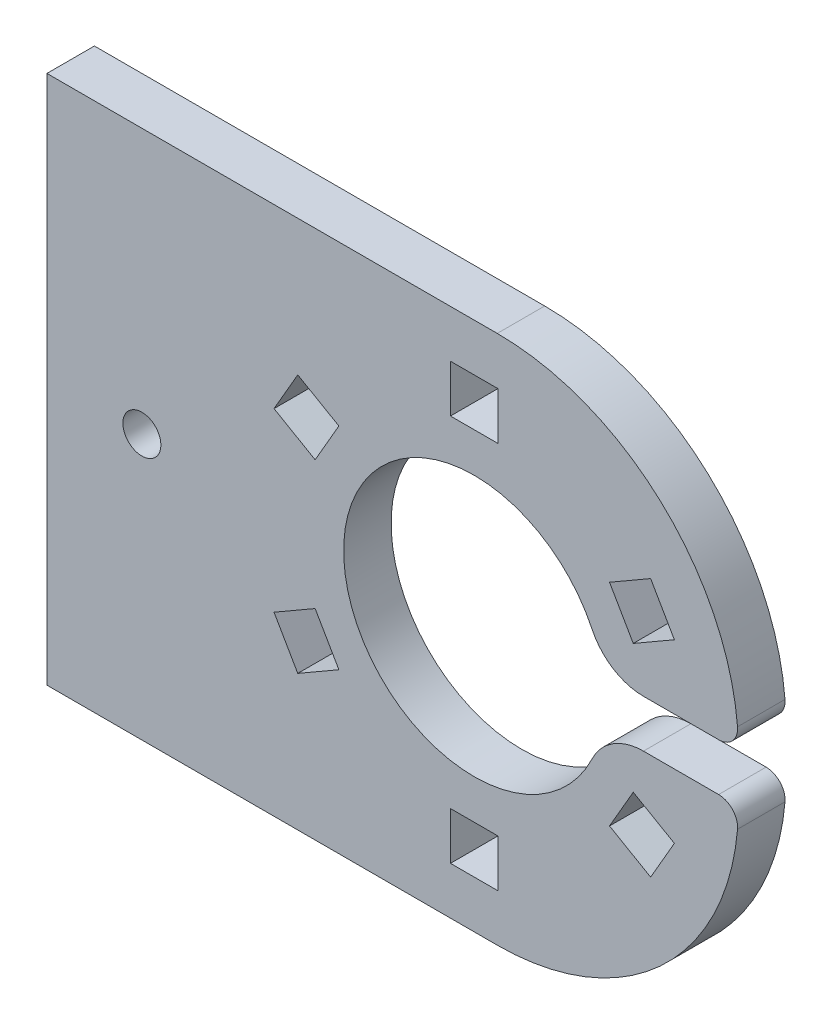
from build123d import *

# Parameters (mm, degrees)
ESQUISSE1_R        = 2
ESQUISSE1_W        = 5
ESQUISSE1_H        = 5
BOSS_EXTRU_1_DEPTH = 5
CONG_1_R           = 2


with BuildPart() as part:
    # Esquisse1 → Boss.-Extru.1 (new body)
    with BuildSketch(Plane.XY):
        with BuildLine():
            Line((-72.827296486, -27.9), (-72.827296486, 27.9))
            Line((-72.827296486, 27.9), (-25.4, 27.9))
            ThreePointArc((-25.4, 27.9), (-7.439487758, 20.460512242), (0, 2.5))
            Line((0, 2.5), (-10, 2.5))
            ThreePointArc((-10, 2.5), (-13.202056301, 3.42586604), (-15.41588754, 5.917721519))
            ThreePointArc((-15.41588754, 5.917721519), (-41.577296486, 0), (-15.41588754, -5.917721519))
            ThreePointArc((-15.41588754, -5.917721519), (-13.202056301, -3.42586604), (-10, -2.5))
            Line((-10, -2.5), (0, -2.5))
            ThreePointArc((0, -2.5), (-7.439487758, -20.460512242), (-25.4, -27.9))
            Line((-25.4, -27.9), (-72.827296486, -27.9))
        make_face()
        with Locations((-62.827296486, 0)):
            Circle(ESQUISSE1_R, mode=Mode.SUBTRACT)
        with Locations((-27.827296486, 20.4)):
            Rectangle(ESQUISSE1_W, ESQUISSE1_H, mode=Mode.SUBTRACT)
        Polygon((-9.245314739, 13.615063509), (-6.745314739, 9.284936491), (-11.075441758, 6.784936491), (-13.575441758, 11.115063509), align=None, mode=Mode.SUBTRACT)
        Polygon((-6.745314739, -9.284936491), (-9.245314739, -13.615063509), (-13.575441758, -11.115063509), (-11.075441758, -6.784936491), align=None, mode=Mode.SUBTRACT)
        with Locations((-27.827296486, -20.4)):
            Rectangle(ESQUISSE1_W, ESQUISSE1_H, mode=Mode.SUBTRACT)
        Polygon((-46.409278233, -13.615063509), (-48.909278233, -9.284936491), (-44.579151214, -6.784936491), (-42.079151214, -11.115063509), align=None, mode=Mode.SUBTRACT)
        Polygon((-48.909278233, 9.284936491), (-46.409278233, 13.615063509), (-42.079151214, 11.115063509), (-44.579151214, 6.784936491), align=None, mode=Mode.SUBTRACT)
    extrude(amount=BOSS_EXTRU_1_DEPTH)

    # Congé1
    cong_1_edges = [part.edges().sort_by_distance(p)[0] for p in [
        (0, 2.5, 2.5),
        (0, -2.5, 2.5),
    ]]
    fillet(cong_1_edges, radius=CONG_1_R)


solid = part.part
